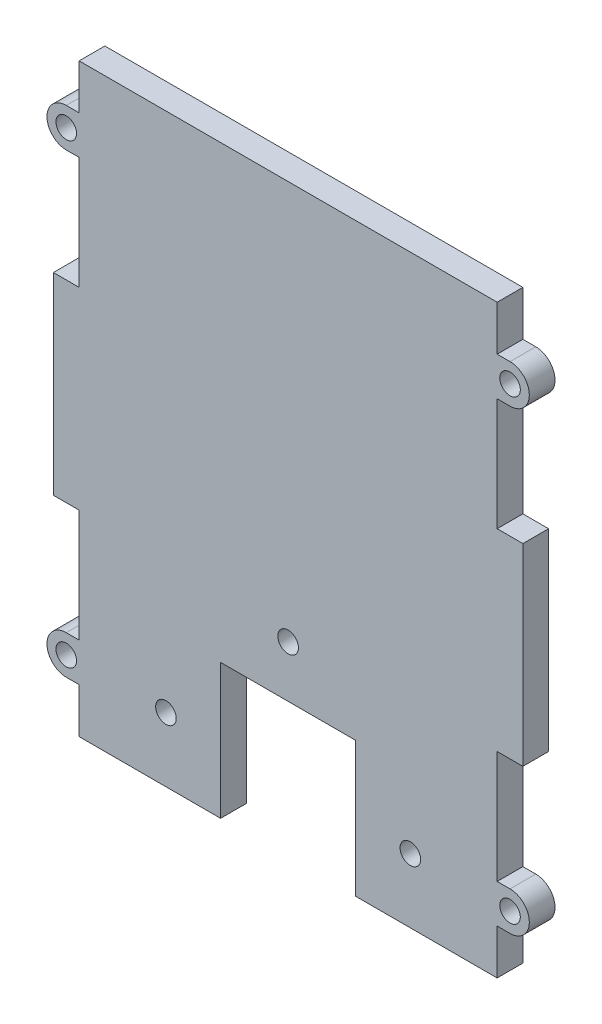
from build123d import *

# Parameters (mm, degrees)
BOSS_EXTRUDE1_DEPTH = 4
SKETCH2_R           = 1.600000002
CUT_EXTRUDE1_DEPTH  = 57.058005673
SKETCH3_R           = 1.6
BOSS_EXTRUDE3_DEPTH = 4
SKETCH4_W           = 4
SKETCH4_H           = 30
BOSS_EXTRUDE4_DEPTH = 4


with BuildPart() as part:
    # Sketch1 → Boss-Extrude1 (new body)
    with BuildSketch(Plane.XY):
        Polygon((-10.5, -45.5), (-10.5, -24.5), (10.5, -24.5), (10.5, -45.5), (32.5, -45.5), (32.5, 45.5), (-32.5, 45.5), (-32.5, -45.5), align=None)
    extrude(amount=BOSS_EXTRUDE1_DEPTH)

    # Sketch2 → Cut-Extrude1 (cut, through all)
    with BuildSketch(Plane(origin=(0, 0, 0), x_dir=(-1, 0, 0), z_dir=(0, 0, -1))):
        with Locations((18.999999999, -35.500025949)):
            Circle(SKETCH2_R)
        with Locations((-1e-09, -16.500025949)):
            Circle(SKETCH2_R)
        with Locations((-19.000000001, -35.500025949)):
            Circle(SKETCH2_R)
    extrude(amount=-CUT_EXTRUDE1_DEPTH, mode=Mode.SUBTRACT)

    # Sketch3 → Boss-Extrude3 (add)
    # profile 1 of 4: a face of its own
    with BuildSketch(Plane(origin=(0, 0, 0), x_dir=(-1, 0, 0), z_dir=(0, 0, -1))):
        with BuildLine():
            Line((34.5, 38.5), (32.5, 38.5))
            Line((32.5, 38.5), (32.5, 32.5))
            Line((32.5, 32.5), (34.5, 32.5))
            ThreePointArc((34.5, 32.5), (37.5, 35.5), (34.5, 38.5))
        make_face()
        with Locations((34.5, 35.5)):
            Circle(SKETCH3_R, mode=Mode.SUBTRACT)
    # profile 2 of 4: a face of its own
    with BuildSketch(Plane(origin=(0, 0, 0), x_dir=(-1, 0, 0), z_dir=(0, 0, -1))):
        with BuildLine():
            Line((34.5, -32.5), (32.5, -32.5))
            Line((32.5, -32.5), (32.5, -38.5))
            Line((32.5, -38.5), (34.5, -38.5))
            ThreePointArc((34.5, -38.5), (37.5, -35.5), (34.5, -32.5))
        make_face()
        with Locations((34.5, -35.5)):
            Circle(SKETCH3_R, mode=Mode.SUBTRACT)
    # profile 3 of 4: a face of its own
    with BuildSketch(Plane(origin=(0, 0, 0), x_dir=(-1, 0, 0), z_dir=(0, 0, -1))):
        with BuildLine():
            Line((-34.5, -38.5), (-32.5, -38.5))
            Line((-32.5, -38.5), (-32.5, -32.5))
            Line((-32.5, -32.5), (-34.5, -32.5))
            ThreePointArc((-34.5, -32.5), (-37.5, -35.5), (-34.5, -38.5))
        make_face()
        with Locations((-34.5, -35.5)):
            Circle(SKETCH3_R, mode=Mode.SUBTRACT)
    # profile 4 of 4: a face of its own
    with BuildSketch(Plane(origin=(0, 0, 0), x_dir=(-1, 0, 0), z_dir=(0, 0, -1))):
        with BuildLine():
            Line((-34.5, 32.5), (-32.5, 32.5))
            Line((-32.5, 32.5), (-32.5, 38.5))
            Line((-32.5, 38.5), (-34.5, 38.5))
            ThreePointArc((-34.5, 38.5), (-37.5, 35.5), (-34.5, 32.5))
        make_face()
        with Locations((-34.5, 35.5)):
            Circle(SKETCH3_R, mode=Mode.SUBTRACT)
    extrude(amount=-BOSS_EXTRUDE3_DEPTH)

    # Sketch4 → Boss-Extrude4 (add)
    with BuildSketch(Plane(origin=(0, 0, 0), x_dir=(-1, 0, 0), z_dir=(0, 0, -1))):
        with Locations((34.5, 0)):
            Rectangle(SKETCH4_W, SKETCH4_H)
        with Locations((-34.5, 0)):
            Rectangle(SKETCH4_W, SKETCH4_H)
    extrude(amount=-BOSS_EXTRUDE4_DEPTH)


solid = part.part
